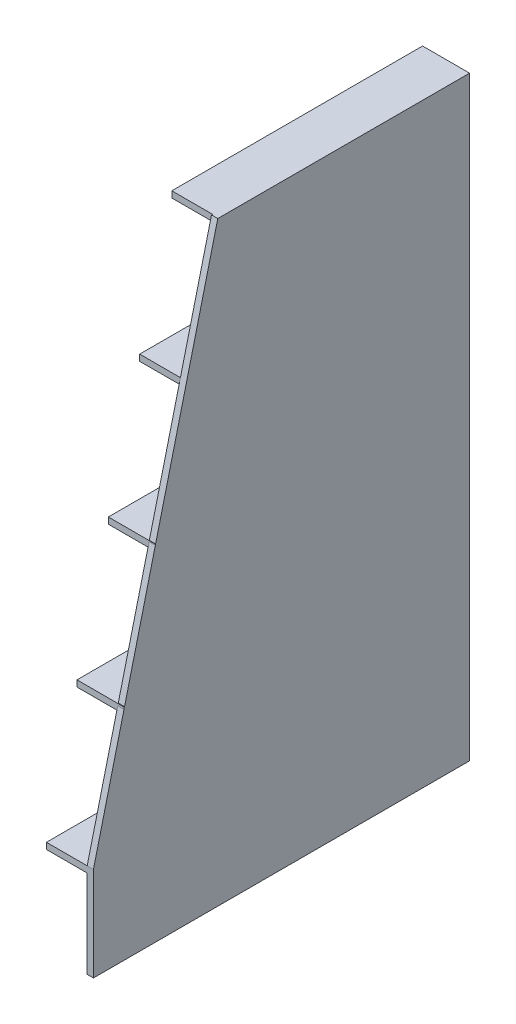
from build123d import *

# Parameters (mm, degrees)
BOSS_EXTRUDE4_DEPTH = 150
BOSS_EXTRUDE5_START = -150
BOSS_EXTRUDE5_DEPTH = 20


with BuildPart() as part:
    # Sketch1 → Boss-Extrude4 (new body)
    with BuildSketch(Plane(origin=(0, 0, 0), x_dir=(0, 0, -1), z_dir=(1, 0, 0))):
        Polygon((-20, 0), (0, 0), (0, 1900), (-800, 1900), (-800, 1880), (-20, 1880), (-20, 1500), (-902.5, 1500), (-902.5, 1480), (-20, 1480), (-20, 1100), (-1002.5, 1100), (-1002.5, 1080), (-20, 1080), (-20, 700), (-1102.5, 700), (-1102.5, 680), (-20, 680), (-20, 300), (-1200, 300), (-1200, 280), (-20, 280), align=None)
    extrude(amount=BOSS_EXTRUDE4_DEPTH)

    # Sketch2 → Boss-Extrude5 (add)
    with BuildSketch(Plane.ZY.offset(BOSS_EXTRUDE5_START)):
        Polygon((0, 1900), (803.333333333, 1900), (1200, 300), (1200, 0), (0, 0), align=None)
    extrude(amount=BOSS_EXTRUDE5_DEPTH)


solid = part.part
